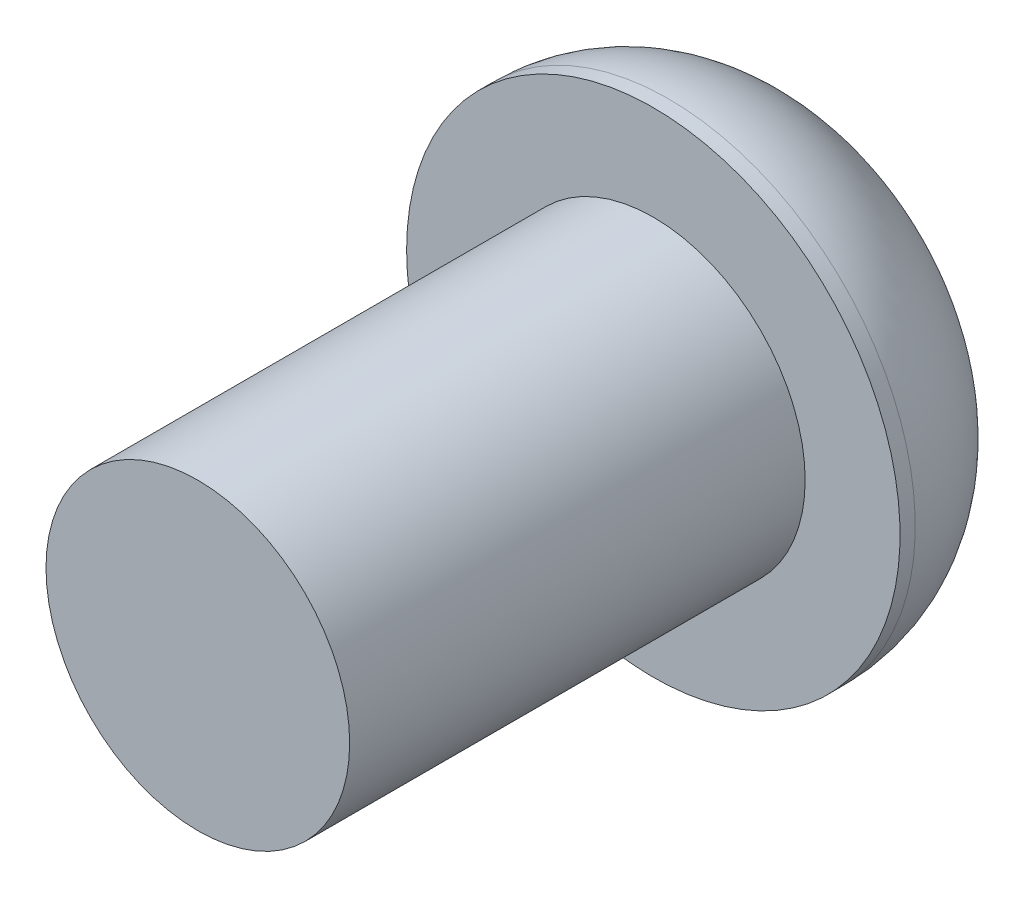
from build123d import *

# Parameters (mm, degrees)
SKETCH_1_R          = 2
EXTRUDE_1_DEPTH     = 6
SKETCH_2_R          = 3.25
EXTRUDE_2_DEPTH     = 2.2
FILLET_1_R          = 2
CUT_EXTRUDE_1_DEPTH = 0.5


with BuildPart() as part:
    # 草图1 → 凸台-拉伸1 (new body)
    with BuildSketch(Plane.XY):
        Circle(SKETCH_1_R)
    extrude(amount=EXTRUDE_1_DEPTH)

    # 草图2 → 凸台-拉伸2 (add)
    with BuildSketch(Plane(origin=(0, 0, 0), x_dir=(-1, 0, 0), z_dir=(0, 0, -1))):
        Circle(SKETCH_2_R)
    extrude(amount=EXTRUDE_2_DEPTH)

    # 圆角1
    fillet_1_edges = [part.edges().sort_by_distance(p)[0] for p in [
        (3.25, 0, -2.2),
    ]]
    fillet(fillet_1_edges, radius=FILLET_1_R)

    # 草图3 → 切除-拉伸1 (cut)
    with BuildSketch(Plane(origin=(0, 0, -2.2), x_dir=(-1, 0, 0), z_dir=(0, 0, -1))):
        Polygon((3.239974874, 0.25), (3.239974874, -0.25), (0.25, -0.25), (0.25, -3.239974874), (-0.25, -3.239974874), (-0.25, -0.25), (-3.239974874, -0.25), (-3.239974874, 0.25), (-0.25, 0.25), (-0.25, 3.239974874), (0.25, 3.239974874), (0.25, 0.25), align=None)
    extrude(amount=-CUT_EXTRUDE_1_DEPTH, mode=Mode.SUBTRACT)


solid = part.part
